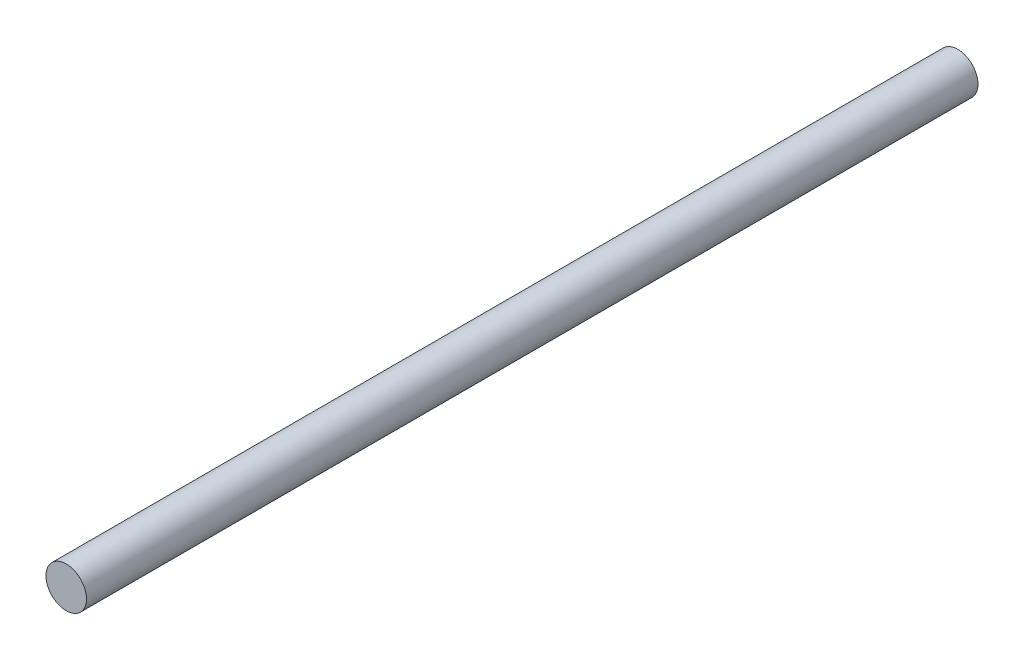
from build123d import *

# Parameters (mm, degrees)
SKETCH1_R           = 0.75
BOSS_EXTRUDE1_DEPTH = 33


with BuildPart() as part:
    # Sketch1 → Boss-Extrude1 (new body)
    with BuildSketch(Plane.XY):
        Circle(SKETCH1_R)
    extrude(amount=BOSS_EXTRUDE1_DEPTH)


solid = part.part
